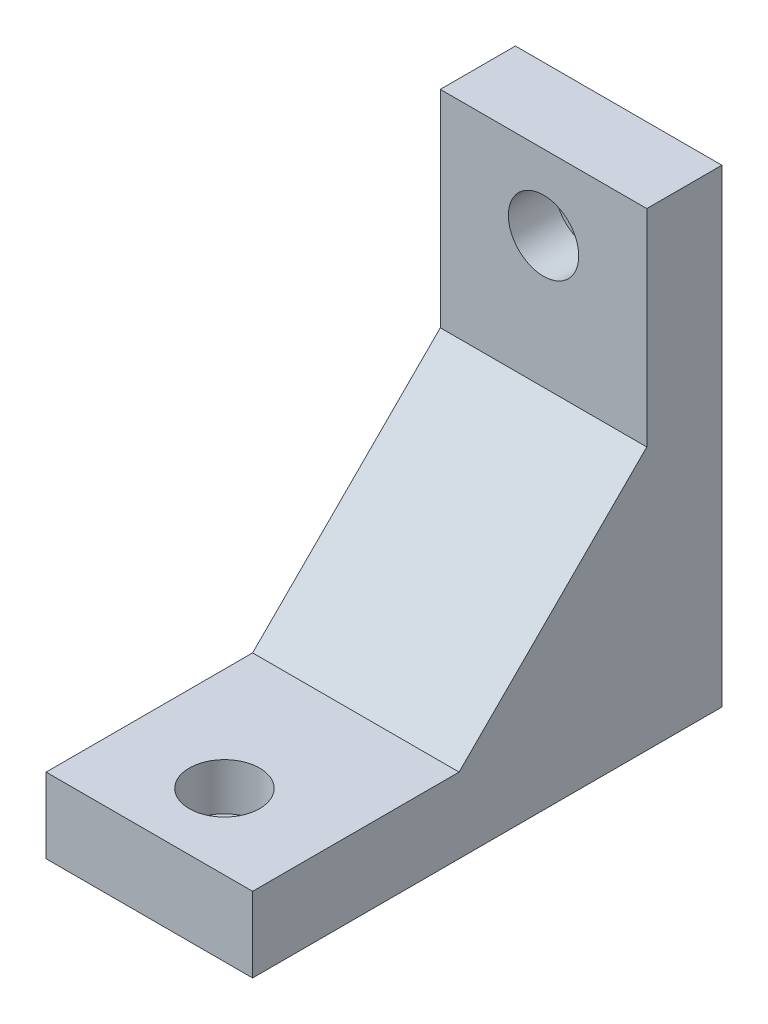
from build123d import *

# Parameters (mm, degrees)
BOSS_EXTRUDE1_DEPTH = 22
SKETCH2_R           = 3.75
CUT_EXTRUDE1_DEPTH  = 5
SKETCH3_R           = 2.4
CUT_EXTRUDE2_DEPTH  = 5
SKETCH4_R           = 3.75
CUT_EXTRUDE3_DEPTH  = 5
SKETCH5_R           = 2.4
CUT_EXTRUDE4_DEPTH  = 5
CHAMFER1_SIZE       = 20


with BuildPart() as part:
    # Sketch1 → Boss-Extrude1 (new body)
    with BuildSketch(Plane(origin=(0, 0, 0), x_dir=(0, 0, -1), z_dir=(1, 0, 0))):
        Polygon((0, 0), (-42, 0), (-42, -8), (8, -8), (8, 42), (0, 42), align=None)
    extrude(amount=BOSS_EXTRUDE1_DEPTH)

    # Sketch2 → Cut-Extrude1 (cut)
    with BuildSketch(Plane.XY):
        with Locations((11, 34)):
            Circle(SKETCH2_R)
    extrude(amount=-CUT_EXTRUDE1_DEPTH, mode=Mode.SUBTRACT)

    # Sketch3 → Cut-Extrude2 (cut)
    with BuildSketch(Plane.XY.offset(-5)):
        with Locations((11, 34)):
            Circle(SKETCH3_R)
    extrude(amount=-CUT_EXTRUDE2_DEPTH, mode=Mode.SUBTRACT)

    # Sketch4 → Cut-Extrude3 (cut)
    with BuildSketch(Plane(origin=(0, 0, 0), x_dir=(1, 0, 0), z_dir=(0, 1, 0))):
        with Locations((11, -34)):
            Circle(SKETCH4_R)
    extrude(amount=-CUT_EXTRUDE3_DEPTH, mode=Mode.SUBTRACT)

    # Sketch5 → Cut-Extrude4 (cut)
    with BuildSketch(Plane(origin=(0, -5, 0), x_dir=(1, 0, 0), z_dir=(0, 1, 0))):
        with Locations((11, -34)):
            Circle(SKETCH5_R)
    extrude(amount=-CUT_EXTRUDE4_DEPTH, mode=Mode.SUBTRACT)

    # Chamfer1
    chamfer1_edges = [part.edges().sort_by_distance(p)[0] for p in [
        (11, 0, 0),
    ]]
    chamfer(chamfer1_edges, length=CHAMFER1_SIZE)


solid = part.part
